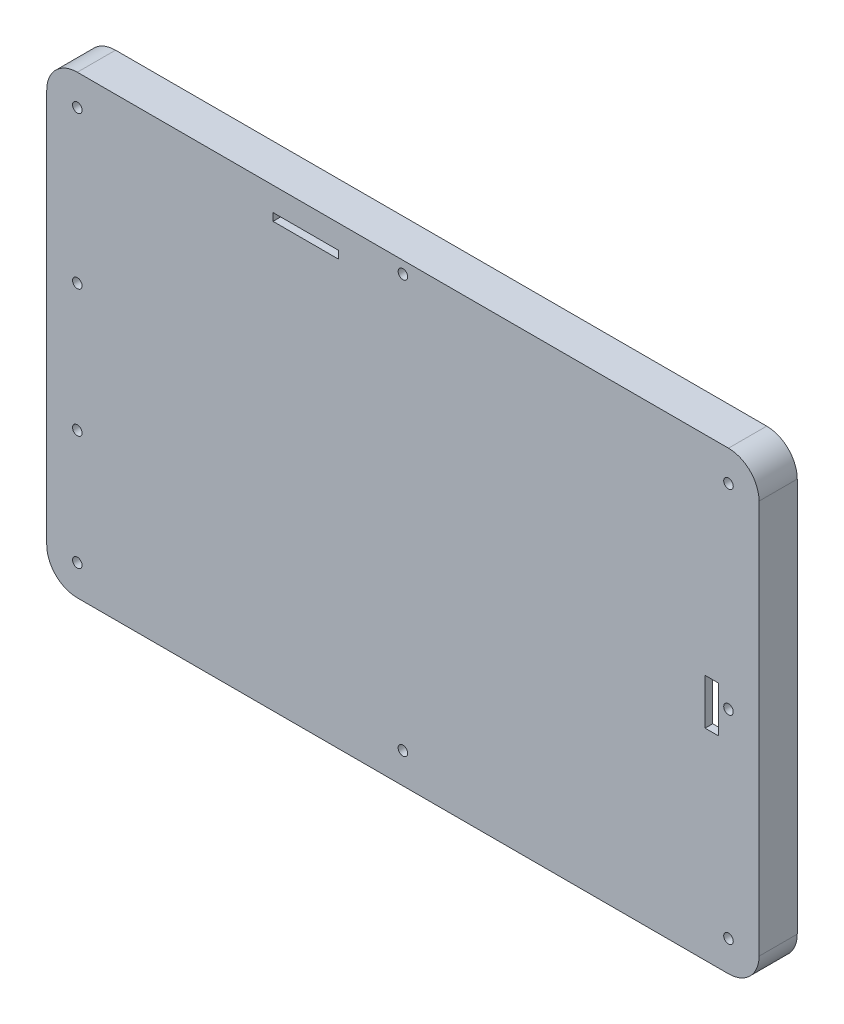
from build123d import *

# Parameters (mm, degrees)
SKETCH1_R           = 1.25
SKETCH1_W           = 156.43
SKETCH1_H           = 89.15
BOSS_EXTRUDE3_DEPTH = 2
SKETCH4_R           = 2.15
SKETCH4_R_2         = 1.15
SKETCH4_R_3         = 2.35
SKETCH4_R_4         = 1.35
BOSS_EXTRUDE4_DEPTH = 2
BOSS_EXTRUDE5_START = 2
SKETCH4_3_R         = 1.15
SKETCH4_3_R_2       = 1.35
BOSS_EXTRUDE5_DEPTH = 2
BOSS_EXTRUDE6_START = 8
SKETCH5_W           = 152.91
SKETCH5_H           = 99.96
BOSS_EXTRUDE6_DEPTH = 8
SKETCH7_W           = 22.9
SKETCH7_H           = 55.24
CUT_EXTRUDE3_DEPTH  = 8
BOSS_EXTRUDE7_START = -8
SKETCH7_3_R         = 2
BOSS_EXTRUDE7_DEPTH = 2
BOSS_EXTRUDE8_START = -6
SKETCH7_4_R         = 1
BOSS_EXTRUDE8_DEPTH = 2
SKETCH8_W           = 2
SKETCH8_H           = 55.24
BOSS_EXTRUDE9_DEPTH = 2
SKETCH1_5_R         = 1.25
CUT_EXTRUDE4_DEPTH  = 118.837043793
SKETCH9_R           = 1.25
CUT_EXTRUDE5_DEPTH  = 118.989698237


with BuildPart() as part:
    # Sketch1 → Boss-Extrude3 (new body)
    # profile 1 of 5: a face of its own
    with BuildSketch(Plane.XY):
        with BuildLine():
            ThreePointArc((-90.129170507, 54.402530662), (-95.786024756, 52.059384912), (-98.129170507, 46.402530662))
            Line((-98.129170507, 46.402530662), (-98.129170507, -56.747469338))
            ThreePointArc((-98.129170507, -56.747469338), (-95.786024756, -62.404323587), (-90.129170507, -64.747469338))
            Line((-90.129170507, -64.747469338), (80.300829493, -64.747469338))
            ThreePointArc((80.300829493, -64.747469338), (85.957683743, -62.404323587), (88.300829493, -56.747469338))
            Line((88.300829493, -56.747469338), (88.300829493, 46.402530662))
            ThreePointArc((88.300829493, 46.402530662), (85.957683743, 52.059384912), (80.300829493, 54.402530662))
            Line((80.300829493, 54.402530662), (-90.129170507, 54.402530662))
        make_face()
        with Locations((-90.129170507, -56.747469338)):
            Circle(SKETCH1_R, mode=Mode.SUBTRACT)
        with Locations((80.300829493, -56.747469338)):
            Circle(SKETCH1_R, mode=Mode.SUBTRACT)
        with BuildLine():
            Line((-89.239170507, -53.907469338), (-89.239170507, 45.524806332))
            ThreePointArc((-89.239170507, 45.524806332), (-91.378326538, 46.448456797), (-89.177120088, 47.212530662))
            Line((-89.177120088, 47.212530662), (-38.909170507, 47.212530662))
            Line((-38.909170507, 47.212530662), (-38.909170507, 48.212530662))
            Line((-38.909170507, 48.212530662), (-21.719170507, 48.212530662))
            Line((-21.719170507, 48.212530662), (-21.719170507, 47.212530662))
            Line((-21.719170507, 47.212530662), (76.680829493, 47.212530662))
            Line((76.680829493, 47.212530662), (76.680829493, -0.147469338))
            Line((76.680829493, -0.147469338), (77.680829493, -0.147469338))
            Line((77.680829493, -0.147469338), (77.680829493, -12.117469338))
            Line((77.680829493, -12.117469338), (76.680829493, -12.117469338))
            Line((76.680829493, -12.117469338), (76.680829493, -53.907469338))
            Line((76.680829493, -53.907469338), (-89.239170507, -53.907469338))
        make_face(mode=Mode.SUBTRACT)
        with Locations((80.300829493, 46.402530662)):
            Circle(SKETCH1_R, mode=Mode.SUBTRACT)
    # profile 2 of 5: a face of its own
    with BuildSketch(Plane.XY):
        with BuildLine():
            ThreePointArc((-88.879170507, 46.402530662), (-88.972667156, 45.928189013), (-89.239170507, 45.524806332))
            Line((-89.239170507, 45.524806332), (-89.239170507, -53.907469338))
            Line((-89.239170507, -53.907469338), (76.680829493, -53.907469338))
            Line((76.680829493, -53.907469338), (76.680829493, -12.117469338))
            Line((76.680829493, -12.117469338), (76.180829493, -12.117469338))
            Line((76.180829493, -12.117469338), (76.180829493, -53.407469338))
            Line((76.180829493, -53.407469338), (-88.739170507, -53.407469338))
            Line((-88.739170507, -53.407469338), (-88.739170507, 46.712530662))
            Line((-88.739170507, 46.712530662), (-38.909170507, 46.712530662))
            Line((-38.909170507, 46.712530662), (-38.909170507, 47.212530662))
            Line((-38.909170507, 47.212530662), (-89.177120088, 47.212530662))
            ThreePointArc((-89.177120088, 47.212530662), (-88.956020256, 46.834061065), (-88.879170507, 46.402530662))
        make_face()
    # profile 3 of 5: a face of its own
    with BuildSketch(Plane.XY):
        Polygon((-38.909170507, 46.212530662), (-38.909170507, 46.712530662), (-88.739170507, 46.712530662), (-88.739170507, -53.407469338), (76.180829493, -53.407469338), (76.180829493, -12.117469338), (74.180829493, -12.117469338), (74.180829493, -0.147469338), (76.180829493, -0.147469338), (76.180829493, 46.712530662), (-21.719170507, 46.712530662), (-21.719170507, 46.212530662), align=None)
        with Locations((-4.914170507, -5.172469338)):
            Rectangle(SKETCH1_W, SKETCH1_H, mode=Mode.SUBTRACT)
    # profile 4 of 5: a face of its own
    with BuildSketch(Plane.XY):
        with Locations((-4.914170507, -5.172469338)):
            Rectangle(SKETCH1_W, SKETCH1_H)
    # profile 5 of 5: a face of its own
    with BuildSketch(Plane.XY):
        Polygon((76.680829493, 47.212530662), (-21.719170507, 47.212530662), (-21.719170507, 46.712530662), (76.180829493, 46.712530662), (76.180829493, -0.147469338), (76.680829493, -0.147469338), align=None)
    extrude(amount=BOSS_EXTRUDE3_DEPTH)

    # Sketch4 → Boss-Extrude4 (add)
    # profile 1 of 34: a face of its own
    with BuildSketch(Plane(origin=(0, 0, 0), x_dir=(-1, 0, 0), z_dir=(0, 0, -1))):
        with Locations(Location((45.009170507, -37.097469338, 0), (0, 0, 180))):
            Circle(SKETCH4_R)
        with Locations((45.009170507, -37.097469338)):
            Circle(SKETCH4_R_2, mode=Mode.SUBTRACT)
    # profile 2 of 34: a face of its own
    with BuildSketch(Plane(origin=(0, 0, 0), x_dir=(-1, 0, 0), z_dir=(0, 0, -1))):
        with Locations((45.009170507, -37.097469338)):
            Circle(SKETCH4_R_2)
    # profile 3 of 34: a face of its own
    with BuildSketch(Plane(origin=(0, 0, 0), x_dir=(-1, 0, 0), z_dir=(0, 0, -1))):
        with Locations(Location((44.509170507, -30.097469338, 0), (0, 0, 180))):
            Circle(SKETCH4_R_3)
        with Locations((44.509170507, -30.097469338)):
            Circle(SKETCH4_R_4, mode=Mode.SUBTRACT)
    # profile 4 of 34: a face of its own
    with BuildSketch(Plane(origin=(0, 0, 0), x_dir=(-1, 0, 0), z_dir=(0, 0, -1))):
        with Locations((44.509170507, -30.097469338)):
            Circle(SKETCH4_R_4)
    # profile 5 of 34: a face of its own
    with BuildSketch(Plane(origin=(0, 0, 0), x_dir=(-1, 0, 0), z_dir=(0, 0, -1))):
        with Locations((45.009170507, 15.532530662)):
            Circle(SKETCH4_R)
    # profile 6 of 34: a face of its own
    with BuildSketch(Plane(origin=(0, 0, 0), x_dir=(-1, 0, 0), z_dir=(0, 0, -1))):
        with Locations((44.509170507, 14.012530662)):
            Circle(SKETCH4_R_3)
        with Locations((44.509170507, 14.012530662)):
            Circle(SKETCH4_R_4, mode=Mode.SUBTRACT)
    # profile 7 of 34: a face of its own
    with BuildSketch(Plane(origin=(0, 0, 0), x_dir=(-1, 0, 0), z_dir=(0, 0, -1))):
        with Locations((45.009170507, 15.532530662)):
            Circle(SKETCH4_R)
    # profile 8 of 34: a face of its own
    with BuildSketch(Plane(origin=(0, 0, 0), x_dir=(-1, 0, 0), z_dir=(0, 0, -1))):
        with Locations((45.009170507, 15.532530662)):
            Circle(SKETCH4_R)
    # profile 9 of 34: a face of its own
    with BuildSketch(Plane(origin=(0, 0, 0), x_dir=(-1, 0, 0), z_dir=(0, 0, -1))):
        with Locations((44.509170507, 14.012530662)):
            Circle(SKETCH4_R_3)
        with Locations((44.509170507, 14.012530662)):
            Circle(SKETCH4_R_4, mode=Mode.SUBTRACT)
    # profile 10 of 34: a face of its own
    with BuildSketch(Plane(origin=(0, 0, 0), x_dir=(-1, 0, 0), z_dir=(0, 0, -1))):
        with Locations((45.009170507, 15.532530662)):
            Circle(SKETCH4_R)
        with Locations((45.009170507, 15.532530662)):
            Circle(SKETCH4_R_2, mode=Mode.SUBTRACT)
    # profile 11 of 34: a face of its own
    with BuildSketch(Plane(origin=(0, 0, 0), x_dir=(-1, 0, 0), z_dir=(0, 0, -1))):
        with Locations((44.509170507, 14.012530662)):
            Circle(SKETCH4_R_3)
    # profile 12 of 34: a face of its own
    with BuildSketch(Plane(origin=(0, 0, 0), x_dir=(-1, 0, 0), z_dir=(0, 0, -1))):
        with Locations((44.509170507, 14.012530662)):
            Circle(SKETCH4_R_3)
    # profile 13 of 34: a face of its own
    with BuildSketch(Plane(origin=(0, 0, 0), x_dir=(-1, 0, 0), z_dir=(0, 0, -1))):
        with Locations((44.509170507, 14.012530662)):
            Circle(SKETCH4_R_3)
    # profile 14 of 34: a face of its own
    with BuildSketch(Plane(origin=(0, 0, 0), x_dir=(-1, 0, 0), z_dir=(0, 0, -1))):
        with Locations((45.009170507, 15.532530662)):
            Circle(SKETCH4_R)
        with Locations((45.009170507, 15.532530662)):
            Circle(SKETCH4_R_2, mode=Mode.SUBTRACT)
    # profile 15 of 34: a face of its own
    with BuildSketch(Plane(origin=(0, 0, 0), x_dir=(-1, 0, 0), z_dir=(0, 0, -1))):
        with BuildLine():
            ThreePointArc((-28.640829493, 15.532530662), (-30.611246643, 17.675017535), (-32.910829493, 15.890441266))
            Line((-32.910829493, 15.890441266), (-32.910829493, 15.174620059))
            ThreePointArc((-32.910829493, 15.174620059), (-30.611246643, 13.39004379), (-28.640829493, 15.532530662))
        make_face()
        with Locations((-30.790829493, 15.532530662)):
            Circle(SKETCH4_R_2, mode=Mode.SUBTRACT)
    # profile 16 of 34: a face of its own
    with BuildSketch(Plane(origin=(0, 0, 0), x_dir=(-1, 0, 0), z_dir=(0, 0, -1))):
        with Locations((-30.790829493, 15.532530662)):
            Circle(SKETCH4_R_2)
    # profile 17 of 34: a face of its own
    with BuildSketch(Plane(origin=(0, 0, 0), x_dir=(-1, 0, 0), z_dir=(0, 0, -1))):
        with BuildLine():
            Line((-32.910829493, 15.174620059), (-32.910829493, 15.890441266))
            ThreePointArc((-32.910829493, 15.890441266), (-32.940829493, 15.532530662), (-32.910829493, 15.174620059))
        make_face()
    # profile 18 of 34: a face of its own
    with BuildSketch(Plane(origin=(0, 0, 0), x_dir=(-1, 0, 0), z_dir=(0, 0, -1))):
        with Locations(Location((-19.620829493, 14.012530662, 0), (0, 0, 180))):
            Circle(SKETCH4_R_3)
        with Locations((-19.620829493, 14.012530662)):
            Circle(SKETCH4_R_4, mode=Mode.SUBTRACT)
    # profile 19 of 34: a face of its own
    with BuildSketch(Plane(origin=(0, 0, 0), x_dir=(-1, 0, 0), z_dir=(0, 0, -1))):
        with Locations((-19.620829493, 14.012530662)):
            Circle(SKETCH4_R_4)
    # profile 20 of 34: a face of its own
    with BuildSketch(Plane(origin=(0, 0, 0), x_dir=(-1, 0, 0), z_dir=(0, 0, -1))):
        with BuildLine():
            ThreePointArc((-32.910829493, -36.739558734), (-32.940829493, -37.097469338), (-32.910829493, -37.455379941))
            Line((-32.910829493, -37.455379941), (-32.910829493, -36.739558734))
        make_face()
    # profile 21 of 34: a face of its own
    with BuildSketch(Plane(origin=(0, 0, 0), x_dir=(-1, 0, 0), z_dir=(0, 0, -1))):
        with BuildLine():
            Line((-32.910829493, -36.739558734), (-32.910829493, -37.455379941))
            ThreePointArc((-32.910829493, -37.455379941), (-30.611246643, -39.23995621), (-28.640829493, -37.097469338))
            ThreePointArc((-28.640829493, -37.097469338), (-30.611246643, -34.954982465), (-32.910829493, -36.739558734))
        make_face()
        with Locations((-30.790829493, -37.097469338)):
            Circle(SKETCH4_R_2, mode=Mode.SUBTRACT)
    # profile 22 of 34: a face of its own
    with BuildSketch(Plane(origin=(0, 0, 0), x_dir=(-1, 0, 0), z_dir=(0, 0, -1))):
        with Locations((-30.790829493, -37.097469338)):
            Circle(SKETCH4_R_2)
    # profile 23 of 34: a face of its own
    with BuildSketch(Plane(origin=(0, 0, 0), x_dir=(-1, 0, 0), z_dir=(0, 0, -1))):
        with Locations(Location((-19.620829493, -30.097469338, 0), (0, 0, 180))):
            Circle(SKETCH4_R_3)
        with Locations((-19.620829493, -30.097469338)):
            Circle(SKETCH4_R_4, mode=Mode.SUBTRACT)
    # profile 24 of 34: a face of its own
    with BuildSketch(Plane(origin=(0, 0, 0), x_dir=(-1, 0, 0), z_dir=(0, 0, -1))):
        with Locations((-19.620829493, -30.097469338)):
            Circle(SKETCH4_R_4)
    # profile 25 of 34: a face of its own
    with BuildSketch(Plane(origin=(0, 0, 0), x_dir=(-1, 0, 0), z_dir=(0, 0, -1))):
        with Locations((45.009170507, 15.532530662)):
            Circle(SKETCH4_R)
        with Locations((45.009170507, 15.532530662)):
            Circle(SKETCH4_R_2, mode=Mode.SUBTRACT)
    # profile 26 of 34: a face of its own
    with BuildSketch(Plane(origin=(0, 0, 0), x_dir=(-1, 0, 0), z_dir=(0, 0, -1))):
        with Locations((44.509170507, 14.012530662)):
            Circle(SKETCH4_R_3)
        with Locations((44.509170507, 14.012530662)):
            Circle(SKETCH4_R_4, mode=Mode.SUBTRACT)
    # profile 27 of 34: a face of its own
    with BuildSketch(Plane(origin=(0, 0, 0), x_dir=(-1, 0, 0), z_dir=(0, 0, -1))):
        with Locations((44.509170507, 14.012530662)):
            Circle(SKETCH4_R_3)
        with Locations((44.509170507, 14.012530662)):
            Circle(SKETCH4_R_4, mode=Mode.SUBTRACT)
    # profile 28 of 34: a face of its own
    with BuildSketch(Plane(origin=(0, 0, 0), x_dir=(-1, 0, 0), z_dir=(0, 0, -1))):
        with Locations((44.509170507, 14.012530662)):
            Circle(SKETCH4_R_4)
    # profile 29 of 34: a face of its own
    with BuildSketch(Plane(origin=(0, 0, 0), x_dir=(-1, 0, 0), z_dir=(0, 0, -1))):
        with Locations((44.509170507, 14.012530662)):
            Circle(SKETCH4_R_4)
    # profile 30 of 34: a face of its own
    with BuildSketch(Plane(origin=(0, 0, 0), x_dir=(-1, 0, 0), z_dir=(0, 0, -1))):
        with Locations((44.509170507, 14.012530662)):
            Circle(SKETCH4_R_4)
    # profile 31 of 34: a face of its own
    with BuildSketch(Plane(origin=(0, 0, 0), x_dir=(-1, 0, 0), z_dir=(0, 0, -1))):
        with Locations((45.009170507, 15.532530662)):
            Circle(SKETCH4_R)
        with Locations((45.009170507, 15.532530662)):
            Circle(SKETCH4_R_2, mode=Mode.SUBTRACT)
    # profile 32 of 34: a face of its own
    with BuildSketch(Plane(origin=(0, 0, 0), x_dir=(-1, 0, 0), z_dir=(0, 0, -1))):
        with Locations((45.009170507, 15.532530662)):
            Circle(SKETCH4_R_2)
    # profile 33 of 34: a face of its own
    with BuildSketch(Plane(origin=(0, 0, 0), x_dir=(-1, 0, 0), z_dir=(0, 0, -1))):
        with Locations((45.009170507, 15.532530662)):
            Circle(SKETCH4_R_2)
    # profile 34 of 34: a face of its own
    with BuildSketch(Plane(origin=(0, 0, 0), x_dir=(-1, 0, 0), z_dir=(0, 0, -1))):
        with Locations((45.009170507, 15.532530662)):
            Circle(SKETCH4_R_2)
    extrude(amount=BOSS_EXTRUDE4_DEPTH)

    # Sketch4<3> → Boss-Extrude5 (add)
    with BuildSketch(Plane(origin=(0, 0, 0), x_dir=(-1, 0, 0), z_dir=(0, 0, -1)).offset(BOSS_EXTRUDE5_START)):
        with Locations((-30.790829493, 15.532530662)):
            Circle(SKETCH4_3_R)
        with Locations((-30.790829493, -37.097469338)):
            Circle(SKETCH4_3_R)
        with Locations((45.009170507, -37.097469338)):
            Circle(SKETCH4_3_R)
        with Locations((45.009170507, 15.532530662)):
            Circle(SKETCH4_3_R)
        with Locations((-19.620829493, -30.097469338)):
            Circle(SKETCH4_3_R_2)
        with Locations((-19.620829493, 14.012530662)):
            Circle(SKETCH4_3_R_2)
        with Locations((44.509170507, 14.012530662)):
            Circle(SKETCH4_3_R_2)
        with Locations((44.509170507, -30.097469338)):
            Circle(SKETCH4_3_R_2)
    extrude(amount=BOSS_EXTRUDE5_DEPTH)

    # Sketch5 → Boss-Extrude6 (add)
    with BuildSketch(Plane(origin=(0, 0, 0), x_dir=(-1, 0, 0), z_dir=(0, 0, -1)).offset(BOSS_EXTRUDE6_START)):
        with BuildLine():
            Line((90.129170507, -64.747469338), (-80.300829493, -64.747469338))
            ThreePointArc((-80.300829493, -64.747469338), (-85.957683743, -62.404323587), (-88.300829493, -56.747469338))
            Line((-88.300829493, -56.747469338), (-88.300829493, 46.402530662))
            ThreePointArc((-88.300829493, 46.402530662), (-85.957683743, 52.059384912), (-80.300829493, 54.402530662))
            Line((-80.300829493, 54.402530662), (90.129170507, 54.402530662))
            ThreePointArc((90.129170507, 54.402530662), (95.786024756, 52.059384912), (98.129170507, 46.402530662))
            Line((98.129170507, 46.402530662), (98.129170507, -56.747469338))
            ThreePointArc((98.129170507, -56.747469338), (95.786024756, -62.404323587), (90.129170507, -64.747469338))
        make_face()
        with Locations((-1.225829493, -1.767469338)):
            Rectangle(SKETCH5_W, SKETCH5_H, mode=Mode.SUBTRACT)
    extrude(amount=-BOSS_EXTRUDE6_DEPTH)

    # Sketch7 → Cut-Extrude3 (cut)
    with BuildSketch(Plane(origin=(0, 0, -8), x_dir=(-1, 0, 0), z_dir=(0, 0, -1))):
        with Locations((86.679170507, 8.782530662)):
            Rectangle(SKETCH7_W, SKETCH7_H)
    extrude(amount=-CUT_EXTRUDE3_DEPTH, mode=Mode.SUBTRACT)

    # Sketch7<3> → Boss-Extrude7 (add)
    with BuildSketch(Plane(origin=(0, 0, -8), x_dir=(-1, 0, 0), z_dir=(0, 0, -1)).offset(BOSS_EXTRUDE7_START)):
        with Locations(Location((95.899170507, -15.727469338, 0), (0, 0, 180))):
            Circle(SKETCH7_3_R)
        with Locations(Location((77.809170507, -15.727469338, 0), (0, 0, 180))):
            Circle(SKETCH7_3_R)
        with Locations(Location((77.809170507, 33.992530662, 0), (0, 0, 180))):
            Circle(SKETCH7_3_R)
        with Locations((95.899170507, 34.502530662)):
            Circle(SKETCH7_3_R)
        with Locations(Location((86.384170507, 12.472530662, 0), (0, 0, 180))):
            Circle(SKETCH7_3_R)
    extrude(amount=BOSS_EXTRUDE7_DEPTH)

    # Sketch7<4> → Boss-Extrude8 (add)
    with BuildSketch(Plane(origin=(0, 0, -8), x_dir=(-1, 0, 0), z_dir=(0, 0, -1)).offset(BOSS_EXTRUDE8_START)):
        with Locations(Location((77.809170507, -15.727469338, 0), (0, 0, 180))):
            Circle(SKETCH7_4_R)
        with Locations(Location((86.384170507, 12.472530662, 0), (0, 0, 180))):
            Circle(SKETCH7_4_R)
        with Locations(Location((77.809170507, 33.992530662, 0), (0, 0, 180))):
            Circle(SKETCH7_4_R)
        with Locations(Location((95.899170507, 34.502530662, 0), (0, 0, 180))):
            Circle(SKETCH7_4_R)
        with Locations(Location((95.899170507, -15.727469338, 0), (0, 0, 180))):
            Circle(SKETCH7_4_R)
    extrude(amount=BOSS_EXTRUDE8_DEPTH)

    # Sketch8 → Boss-Extrude9 (add)
    with BuildSketch(Plane(origin=(0, 0, 0), x_dir=(-1, 0, 0), z_dir=(0, 0, -1))):
        with Locations((97.129170507, 8.782530662)):
            Rectangle(SKETCH8_W, SKETCH8_H)
    extrude(amount=BOSS_EXTRUDE9_DEPTH)

    # Sketch1<5> → Cut-Extrude4 (cut, through all)
    with BuildSketch(Plane.XY):
        with Locations((-90.129170507, -56.747469338)):
            Circle(SKETCH1_5_R)
        with Locations((80.300829493, -56.747469338)):
            Circle(SKETCH1_5_R)
        with Locations((80.300829493, 46.402530662)):
            Circle(SKETCH1_5_R)
        with Locations((-90.129170507, 46.402530662)):
            Circle(SKETCH1_5_R)
    extrude(amount=-CUT_EXTRUDE4_DEPTH, mode=Mode.SUBTRACT)

    # Sketch9 → Cut-Extrude5 (cut, through all)
    with BuildSketch(Plane(origin=(0, 0, -8), x_dir=(-1, 0, 0), z_dir=(0, 0, -1))):
        with Locations((-80.300829493, -4.767469338)):
            Circle(SKETCH9_R)
        with Locations((4.909170507, -56.747469338)):
            Circle(SKETCH9_R)
        with Locations((4.909170507, 51.252530662)):
            Circle(SKETCH9_R)
        with Locations((90.129170507, -26.747469338)):
            Circle(SKETCH9_R)
        with Locations((90.129170507, 6.592530662)):
            Circle(SKETCH9_R)
    extrude(amount=-CUT_EXTRUDE5_DEPTH, mode=Mode.SUBTRACT)


solid = part.part
